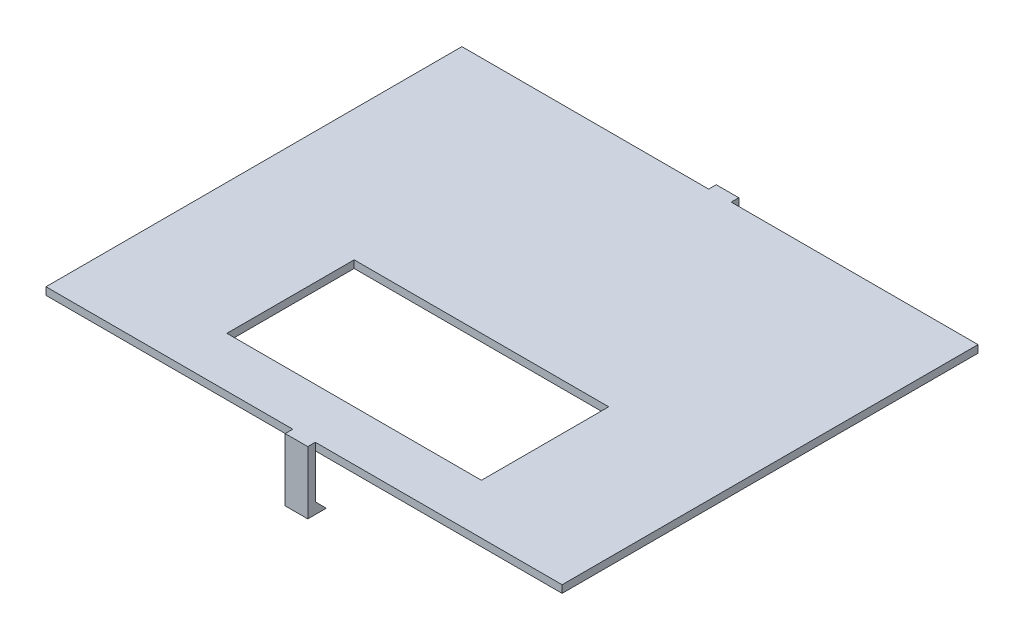
from build123d import *

# Parameters (mm, degrees)
SKETCH1_W           = 103
SKETCH1_H           = 83
BOSS_EXTRUDE1_DEPTH = 1.5
BOSS_EXTRUDE2_DEPTH = 2.25
SKETCH3_W           = 50.8
SKETCH3_H           = 25.4
CUT_EXTRUDE1_DEPTH  = 1.5


with BuildPart() as part:
    # Sketch1 → Boss-Extrude1 (new body)
    with BuildSketch(Plane(origin=(0, 0, 0), x_dir=(1, 0, 0), z_dir=(0, 1, 0))):
        with Locations((18.292349727, -12.091530055)):
            Rectangle(SKETCH1_W, SKETCH1_H)
    extrude(amount=BOSS_EXTRUDE1_DEPTH)

    # Sketch2 → Boss-Extrude2 (add, symmetric)
    with BuildSketch(Plane(origin=(18.292349727, 0, 0), x_dir=(0, 0, -1), z_dir=(1, 0, 0))):
        Polygon((-53.591530055, 1.5), (-55.101530055, 1.5), (-55.101530055, -11), (-51.395356897, -11), (-53.601530055, -8.793826843), (-53.601530055, 0), (-53.591530055, 0), align=None)
        Polygon((29.408469945, 0), (29.408469945, 1.5), (30.918469945, 1.5), (30.918469945, -11), (27.212296788, -11), (29.418469945, -8.793826843), (29.418469945, 0), align=None)
    extrude(amount=BOSS_EXTRUDE2_DEPTH, both=True)

    # Sketch3 → Cut-Extrude1 (cut)
    with BuildSketch(Plane(origin=(0, 1.5, 0), x_dir=(1, 0, 0), z_dir=(0, 1, 0))):
        with Locations((18.292349727, -30.891530055)):
            Rectangle(SKETCH3_W, SKETCH3_H)
    extrude(amount=-CUT_EXTRUDE1_DEPTH, mode=Mode.SUBTRACT)


solid = part.part
